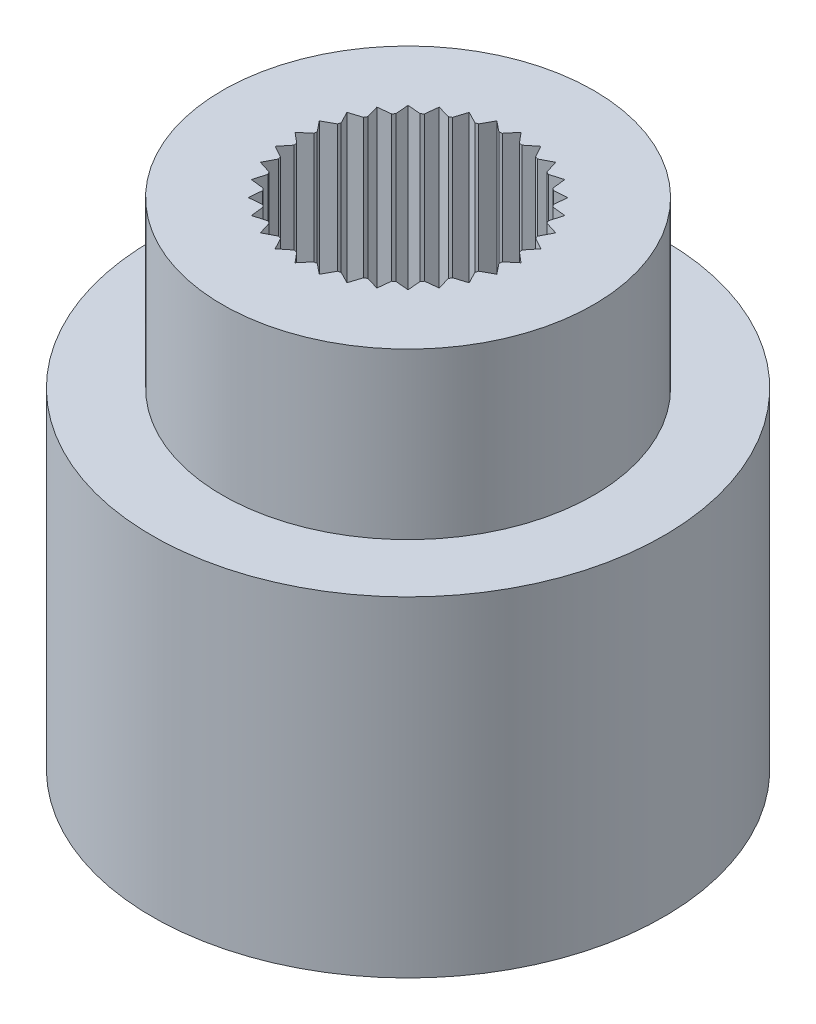
from build123d import *

# Parameters (mm, degrees)
CUT_EXTRUDE1_DEPTH = 6
CUT_EXTRUDE2_DEPTH = 6


with BuildPart() as part:
    # Sketch1 → Revolve1 (revolve)
    with BuildSketch(Plane(origin=(0, 0, 0), x_dir=(0, 0, -1), z_dir=(1, 0, 0)), mode=Mode.PRIVATE) as revolve1_sk:
        Polygon((-6.2, 0), (-6.2, 8), (-4.5, 8), (-4.5, 12), (-2.5, 12), (-2.5, 6), (-4.2, 6), (-4.2, 0), align=None)
    revolve(revolve1_sk.sketch.rotate(Axis((0, 0, 0), (0, 1, 0)), 180), axis=Axis((0, 0, 0), (0, 1, 0)))

    # Sketch2 → Cut-Extrude1 (cut)
    with BuildSketch(Plane.XZ):
        with BuildLine():
            Line((-0.232934528, 4.147783552), (0, 4.425384113))
            Line((0, 4.425384113), (0.232934528, 4.147783552))
            Line((0.232934528, 4.147783552), (0.495485814, 4.397558226))
            Line((0.495485814, 4.397558226), (0.695874297, 4.095622767))
            Line((0.695874297, 4.095622767), (0.984740606, 4.314430494))
            Line((0.984740606, 4.314430494), (1.150063043, 3.99195715))
            Line((1.150063043, 3.99195715), (1.461611714, 4.177046294))
            Line((1.461611714, 4.177046294), (1.589789079, 3.838090355))
            Line((1.589789079, 3.838090355), (1.920102206, 3.987133314))
            Line((1.920102206, 3.987133314), (2.009522595, 3.635957347))
            Line((2.009522595, 3.635957347), (2.354446299, 3.747079819))
            Line((2.354446299, 3.747079819), (2.403985198, 3.388100066))
            Line((2.403985198, 3.388100066), (2.759181864, 3.459904621))
            Line((2.759181864, 3.459904621), (2.768216292, 3.097635461))
            Line((2.768216292, 3.097635461), (3.129219115, 3.129219115))
            Line((3.129219115, 3.129219115), (3.097635461, 2.768216292))
            Line((3.097635461, 2.768216292), (3.459904621, 2.759181864))
            Line((3.459904621, 2.759181864), (3.388100066, 2.403985198))
            Line((3.388100066, 2.403985198), (3.747079819, 2.354446299))
            Line((3.747079819, 2.354446299), (3.635957347, 2.009522595))
            Line((3.635957347, 2.009522595), (3.987133314, 1.920102206))
            Line((3.987133314, 1.920102206), (3.838090355, 1.589789079))
            Line((3.838090355, 1.589789079), (4.177046294, 1.461611714))
            Line((4.177046294, 1.461611714), (3.99195715, 1.150063043))
            Line((3.99195715, 1.150063043), (4.314430494, 0.984740606))
            Line((4.314430494, 0.984740606), (4.095622767, 0.695874297))
            Line((4.095622767, 0.695874297), (4.397558226, 0.495485814))
            Line((4.397558226, 0.495485814), (4.147783552, 0.232934528))
            Line((4.147783552, 0.232934528), (4.425384113, 0))
            Line((4.425384113, 0), (4.147783552, -0.232934528))
            Line((4.147783552, -0.232934528), (4.397558226, -0.495485814))
            Line((4.397558226, -0.495485814), (4.095622767, -0.695874297))
            Line((4.095622767, -0.695874297), (4.314430494, -0.984740606))
            Line((4.314430494, -0.984740606), (3.99195715, -1.150063043))
            Line((3.99195715, -1.150063043), (4.177046294, -1.461611714))
            Line((4.177046294, -1.461611714), (3.838090355, -1.589789079))
            Line((3.838090355, -1.589789079), (3.987133314, -1.920102206))
            Line((3.987133314, -1.920102206), (3.635957347, -2.009522595))
            Line((3.635957347, -2.009522595), (3.747079819, -2.354446299))
            Line((3.747079819, -2.354446299), (3.388100066, -2.403985198))
            Line((3.388100066, -2.403985198), (3.459904621, -2.759181864))
            Line((3.459904621, -2.759181864), (3.097635461, -2.768216292))
            Line((3.097635461, -2.768216292), (3.129219115, -3.129219115))
            Line((3.129219115, -3.129219115), (2.768216292, -3.097635461))
            Line((2.768216292, -3.097635461), (2.759181864, -3.459904621))
            Line((2.759181864, -3.459904621), (2.403985198, -3.388100066))
            Line((2.403985198, -3.388100066), (2.354446299, -3.747079819))
            Line((2.354446299, -3.747079819), (2.009522595, -3.635957347))
            Line((2.009522595, -3.635957347), (1.920102206, -3.987133314))
            Line((1.920102206, -3.987133314), (1.589789079, -3.838090355))
            Line((1.589789079, -3.838090355), (1.461611714, -4.177046294))
            Line((1.461611714, -4.177046294), (1.150063043, -3.99195715))
            Line((1.150063043, -3.99195715), (0.984740606, -4.314430494))
            Line((0.984740606, -4.314430494), (0.695874297, -4.095622767))
            Line((0.695874297, -4.095622767), (0.495485814, -4.397558226))
            Line((0.495485814, -4.397558226), (0.232934528, -4.147783552))
            Line((0.232934528, -4.147783552), (0, -4.425384113))
            Line((0, -4.425384113), (-0.232934528, -4.147783552))
            Line((-0.232934528, -4.147783552), (-0.495485814, -4.397558226))
            Line((-0.495485814, -4.397558226), (-0.695874297, -4.095622767))
            Line((-0.695874297, -4.095622767), (-0.984740606, -4.314430494))
            Line((-0.984740606, -4.314430494), (-1.150063043, -3.99195715))
            Line((-1.150063043, -3.99195715), (-1.461611714, -4.177046294))
            Line((-1.461611714, -4.177046294), (-1.589789079, -3.838090355))
            Line((-1.589789079, -3.838090355), (-1.920102206, -3.987133314))
            Line((-1.920102206, -3.987133314), (-2.009522595, -3.635957347))
            Line((-2.009522595, -3.635957347), (-2.354446299, -3.747079819))
            Line((-2.354446299, -3.747079819), (-2.403985198, -3.388100066))
            Line((-2.403985198, -3.388100066), (-2.759181864, -3.459904621))
            Line((-2.759181864, -3.459904621), (-2.768216292, -3.097635461))
            Line((-2.768216292, -3.097635461), (-3.129219115, -3.129219115))
            Line((-3.129219115, -3.129219115), (-3.097635461, -2.768216292))
            Line((-3.097635461, -2.768216292), (-3.459904621, -2.759181864))
            Line((-3.459904621, -2.759181864), (-3.388100066, -2.403985198))
            Line((-3.388100066, -2.403985198), (-3.747079819, -2.354446299))
            Line((-3.747079819, -2.354446299), (-3.635957347, -2.009522595))
            Line((-3.635957347, -2.009522595), (-3.987133314, -1.920102206))
            Line((-3.987133314, -1.920102206), (-3.838090355, -1.589789079))
            Line((-3.838090355, -1.589789079), (-4.177046294, -1.461611714))
            Line((-4.177046294, -1.461611714), (-3.99195715, -1.150063043))
            Line((-3.99195715, -1.150063043), (-4.314430494, -0.984740606))
            Line((-4.314430494, -0.984740606), (-4.095622767, -0.695874297))
            Line((-4.095622767, -0.695874297), (-4.397558226, -0.495485814))
            Line((-4.397558226, -0.495485814), (-4.147783552, -0.232934528))
            Line((-4.147783552, -0.232934528), (-4.425384113, 0))
            Line((-4.425384113, 0), (-4.147783552, 0.232934528))
            Line((-4.147783552, 0.232934528), (-4.397558226, 0.495485814))
            Line((-4.397558226, 0.495485814), (-4.095622767, 0.695874297))
            Line((-4.095622767, 0.695874297), (-4.314430494, 0.984740606))
            Line((-4.314430494, 0.984740606), (-3.99195715, 1.150063043))
            Line((-3.99195715, 1.150063043), (-4.177046294, 1.461611714))
            Line((-4.177046294, 1.461611714), (-3.858182334, 1.582191227))
            ThreePointArc((-3.858182334, 1.582191227), (-3.852577651, 1.595789913), (-3.846925037, 1.609368745))
            Line((-3.846925037, 1.609368745), (-3.987133314, 1.920102206))
            Line((-3.987133314, 1.920102206), (-3.656773681, 2.004222105))
            ThreePointArc((-3.656773681, 2.004222105), (-3.649681669, 2.017107759), (-3.642544252, 2.029968319))
            Line((-3.642544252, 2.029968319), (-3.747079819, 2.354446299))
            Line((-3.747079819, 2.354446299), (-3.409378978, 2.401048726))
            ThreePointArc((-3.409378978, 2.401048726), (-3.400888824, 2.413059305), (-3.392356359, 2.425039863))
            Line((-3.392356359, 2.425039863), (-3.459904621, 2.759181864))
            Line((-3.459904621, 2.759181864), (-3.119109356, 2.767680767))
            ThreePointArc((-3.119109356, 2.767680767), (-3.109327828, 2.77866523), (-3.099507616, 2.789615124))
            Line((-3.099507616, 2.789615124), (-3.129219115, 3.129219115))
            Line((-3.129219115, 3.129219115), (-2.789615124, 3.099507616))
            ThreePointArc((-2.789615124, 3.099507616), (-2.77866523, 3.109327828), (-2.767680767, 3.119109356))
            Line((-2.767680767, 3.119109356), (-2.759181864, 3.459904621))
            Line((-2.759181864, 3.459904621), (-2.425039863, 3.392356359))
            ThreePointArc((-2.425039863, 3.392356359), (-2.413059305, 3.400888824), (-2.401048726, 3.409378978))
            Line((-2.401048726, 3.409378978), (-2.354446299, 3.747079819))
            Line((-2.354446299, 3.747079819), (-2.009522595, 3.635957347))
            Line((-2.009522595, 3.635957347), (-1.920102206, 3.987133314))
            Line((-1.920102206, 3.987133314), (-1.609368745, 3.846925037))
            ThreePointArc((-1.609368745, 3.846925037), (-1.595789913, 3.852577651), (-1.582191227, 3.858182334))
            Line((-1.582191227, 3.858182334), (-1.461611714, 4.177046294))
            Line((-1.461611714, 4.177046294), (-1.150063043, 3.99195715))
            Line((-1.150063043, 3.99195715), (-0.984740606, 4.314430494))
            Line((-0.984740606, 4.314430494), (-0.695874297, 4.095622767))
            Line((-0.695874297, 4.095622767), (-0.495485814, 4.397558226))
            Line((-0.495485814, 4.397558226), (-0.232934528, 4.147783552))
        make_face()
    extrude(amount=-CUT_EXTRUDE1_DEPTH, mode=Mode.SUBTRACT)

    # Sketch3 → Cut-Extrude2 (cut)
    with BuildSketch(Plane(origin=(0, 12, 0), x_dir=(1, 0, 0), z_dir=(0, 1, 0))):
        Polygon((0, 2.738871568), (-0.241418239, 2.451160514), (-0.534327336, 2.686244919), (-0.714977149, 2.35696379), (-1.048120772, 2.530387384), (-1.161059889, 2.17219027), (-1.521635515, 2.277288481), (-1.562523748, 1.903940695), (-1.936674658, 1.936674658), (-1.903940695, 1.562523748), (-2.277288481, 1.521635515), (-2.17219027, 1.161059889), (-2.530387384, 1.048120772), (-2.35696379, 0.714977149), (-2.686244919, 0.534327336), (-2.451160514, 0.241418239), (-2.738871568, 0), (-2.451160514, -0.241418239), (-2.686244919, -0.534327336), (-2.35696379, -0.714977149), (-2.530387384, -1.048120772), (-2.17219027, -1.161059889), (-2.277288481, -1.521635515), (-1.903940695, -1.562523748), (-1.936674658, -1.936674658), (-1.562523748, -1.903940695), (-1.521635515, -2.277288481), (-1.161059889, -2.17219027), (-1.048120772, -2.530387384), (-0.714977149, -2.35696379), (-0.534327336, -2.686244919), (-0.241418239, -2.451160514), (0, -2.738871568), (0.241418239, -2.451160514), (0.534327336, -2.686244919), (0.714977149, -2.35696379), (1.048120772, -2.530387384), (1.161059889, -2.17219027), (1.521635515, -2.277288481), (1.562523748, -1.903940695), (1.936674658, -1.936674658), (1.903940695, -1.562523748), (2.277288481, -1.521635515), (2.17219027, -1.161059889), (2.530387384, -1.048120772), (2.35696379, -0.714977149), (2.686244919, -0.534327336), (2.451160514, -0.241418239), (2.738871568, 0), (2.451160514, 0.241418239), (2.686244919, 0.534327336), (2.35696379, 0.714977149), (2.530387384, 1.048120772), (2.17219027, 1.161059889), (2.277288481, 1.521635515), (1.903940695, 1.562523748), (1.936674658, 1.936674658), (1.562523748, 1.903940695), (1.521635515, 2.277288481), (1.161059889, 2.17219027), (1.048120772, 2.530387384), (0.714977149, 2.35696379), (0.534327336, 2.686244919), (0.241418239, 2.451160514), align=None)
    extrude(amount=-CUT_EXTRUDE2_DEPTH, mode=Mode.SUBTRACT)


solid = part.part
